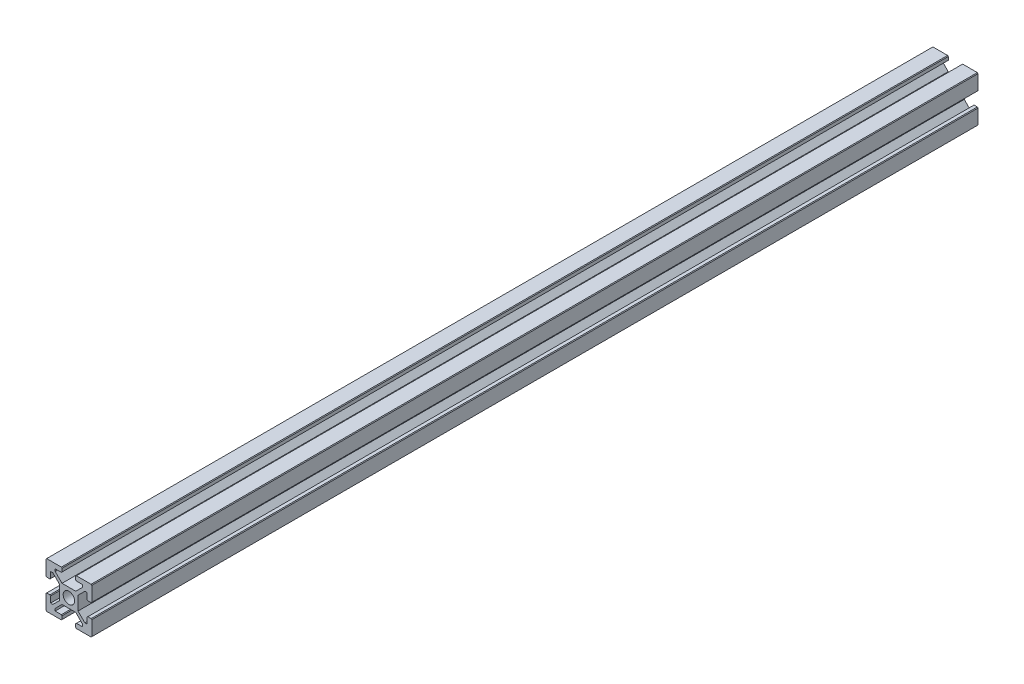
from build123d import *

# Parameters (mm, degrees)
SKETCH1_R           = 2.5
BOSS_EXTRUDE1_DEPTH = 387.35
CHAMFER1_SIZE       = 0.2828


with BuildPart() as part:
    # Sketch1 → Boss-Extrude1 (new body)
    with BuildSketch(Plane.XY):
        Polygon((-3, 8), (-3, 10), (-10, 10), (-10, 3), (-8, 3), (-8, 6), (-7, 6), (-4, 3), (-4, -3), (-7, -6), (-8, -6), (-8, -3), (-10, -3), (-10, -10), (-3, -10), (-3, -8), (-6, -8), (-6, -7), (-3, -4), (3, -4), (6, -7), (6, -8), (3, -8), (3, -10), (10, -10), (10, -3), (8, -3), (8, -6), (7, -6), (4, -3), (4, 3), (7, 6), (8, 6), (8, 3), (10, 3), (10, 10), (3, 10), (3, 8), (6, 8), (6, 7), (3, 4), (-3, 4), (-6, 7), (-6, 8), align=None)
        Circle(SKETCH1_R, mode=Mode.SUBTRACT)
    extrude(amount=BOSS_EXTRUDE1_DEPTH)

    # Chamfer1
    chamfer1_edges = [part.edges().sort_by_distance(p)[0] for p in [
        (-8, -3, 193.675),
        (-8, 3, 193.675),
        (-10, 3, 193.675),
        (-10, 10, 193.675),
        (-3, 10, 193.675),
        (-3, 8, 193.675),
        (3, 8, 193.675),
        (3, 10, 193.675),
        (10, 10, 193.675),
        (10, 3, 193.675),
        (8, 3, 193.675),
        (8, -3, 193.675),
        (10, -3, 193.675),
        (10, -10, 193.675),
        (3, -10, 193.675),
        (3, -8, 193.675),
        (-3, -8, 193.675),
        (-3, -10, 193.675),
        (-10, -10, 193.675),
        (-10, -3, 193.675),
    ]]
    chamfer(chamfer1_edges, length=CHAMFER1_SIZE)


solid = part.part
